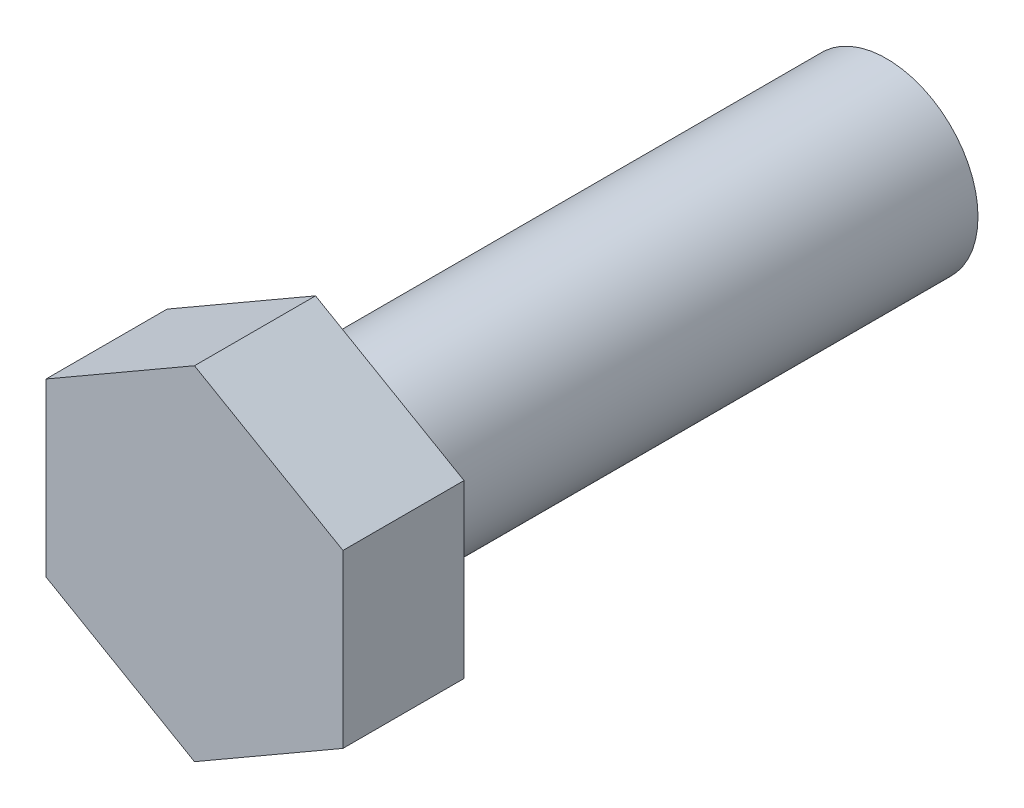
from build123d import *

# Parameters (mm, degrees)
EXTRUDE_1_DEPTH = 5.3
SKETCH_3_R      = 4
EXTRUDE_2_DEPTH = 25


with BuildPart() as part:
    # Эскиз1 → Бобышка-Вытянуть1 (new body)
    with BuildSketch(Plane.XY):
        Polygon((0, 7.505553499), (-6.5, 3.75277675), (-6.5, -3.75277675), (0, -7.505553499), (6.5, -3.75277675), (6.5, 3.75277675), align=None)
    extrude(amount=EXTRUDE_1_DEPTH)

    # Эскиз3 → Бобышка-Вытянуть2 (add)
    with BuildSketch(Plane(origin=(0, 0, 0), x_dir=(-1, 0, 0), z_dir=(0, 0, -1))):
        with Locations(Location((0, 0, 0), (0, 0, 180))):
            Circle(SKETCH_3_R)
    extrude(amount=EXTRUDE_2_DEPTH)


solid = part.part
